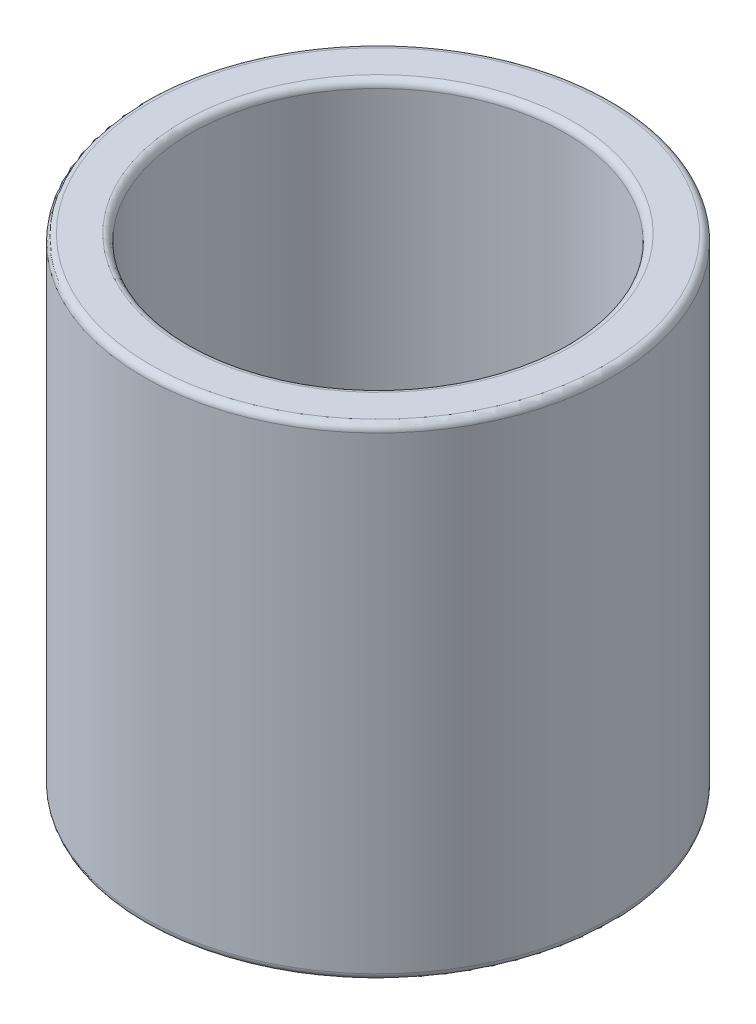
from build123d import *

# Parameters (mm, degrees)
SKETCH1_R           = 5
SKETCH1_R_2         = 4
BOSS_EXTRUDE1_DEPTH = 10.287
FILLET1_R           = 0.15


with BuildPart() as part:
    # Sketch1 → Boss-Extrude1 (new body)
    with BuildSketch(Plane(origin=(0, 0, 0), x_dir=(1, 0, 0), z_dir=(0, 1, 0))):
        with Locations(Location((0, 0, 0), (0, 0, 270))):
            Circle(SKETCH1_R)
        with Locations(Location((0, 0, 0), (0, 0, 270))):
            Circle(SKETCH1_R_2, mode=Mode.SUBTRACT)
    extrude(amount=BOSS_EXTRUDE1_DEPTH)

    # Fillet1
    fillet1_edges = [part.edges().sort_by_distance(p)[0] for p in [
        (0, 0, -5),
        (0, 10.287, -5),
        (0, 0, -4),
        (0, 10.287, -4),
    ]]
    fillet(fillet1_edges, radius=FILLET1_R)


solid = part.part
